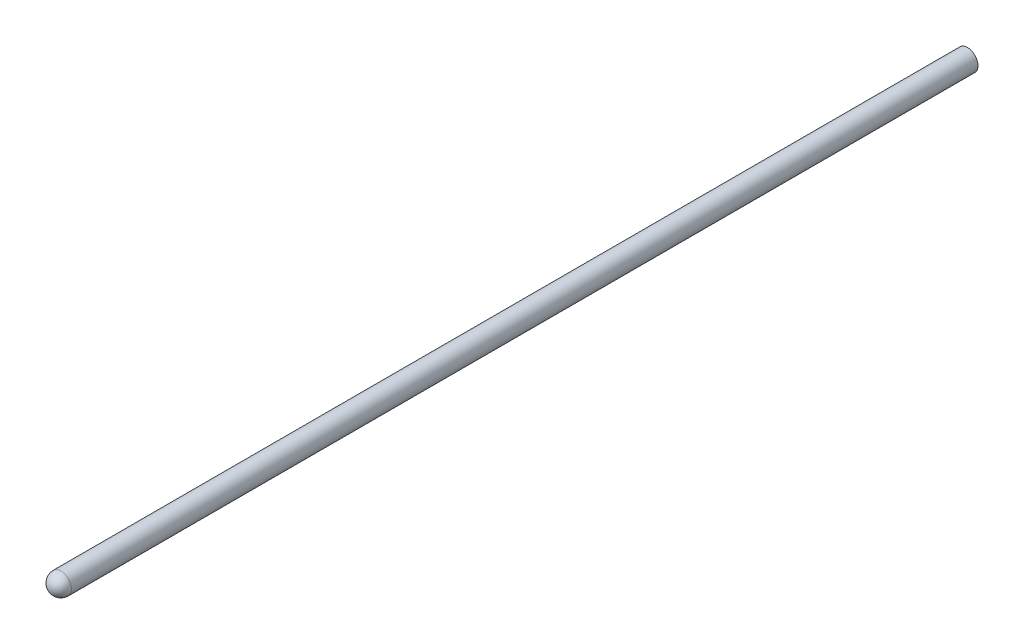
from build123d import *

# Parameters (mm, degrees)
SKETCH1_R           = 6.35
BOSS_EXTRUDE1_DEPTH = 273.05
DOME2_FACE_RADIUS   = 6.35
DOME2_HEIGHT        = 6.35


with BuildPart() as part:
    # Sketch1 → Boss-Extrude1 (new, symmetric)
    with BuildSketch(Plane.XY):
        Circle(SKETCH1_R)
    extrude(amount=BOSS_EXTRUDE1_DEPTH, both=True)

    # Dome2: a dome of height H over a round flat face of radius A is a cap of a sphere of radius (A * A + H * H) / (2 * H)
    dome2_r = (DOME2_FACE_RADIUS * DOME2_FACE_RADIUS + DOME2_HEIGHT * DOME2_HEIGHT) / (2 * DOME2_HEIGHT)
    dome2_base = Plane((0, 0, 273.05), z_dir=(0, 0, 1))
    with Locations(dome2_base.offset(DOME2_HEIGHT - dome2_r)):
        dome2_ball = Sphere(dome2_r, mode=Mode.PRIVATE)
    add(split(dome2_ball, bisect_by=dome2_base, keep=Keep.TOP, mode=Mode.PRIVATE))


solid = part.part
